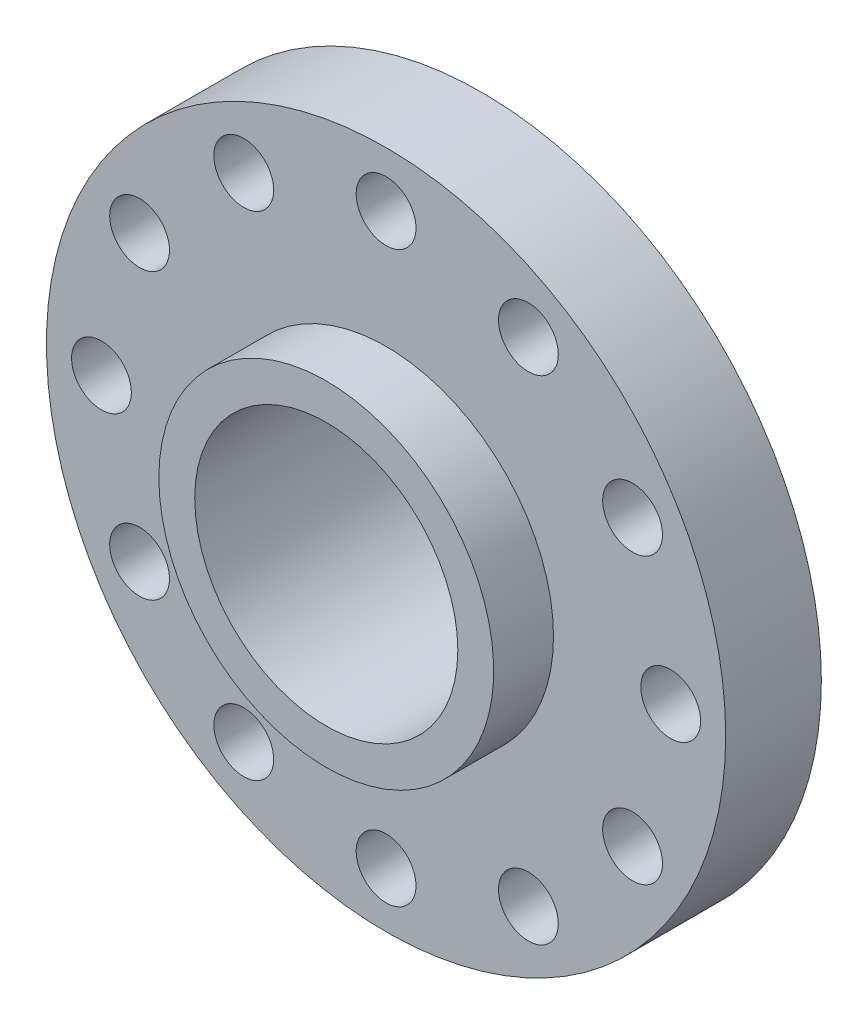
from build123d import *
from build123d.topology import SkipClean

# Parameters (mm, degrees)
SKETCH1_R           = 28.4
SKETCH1_R_2         = 11
BOSS_EXTRUDE1_DEPTH = 8
BOSS_EXTRUDE2_START = 5
SKETCH2_R           = 14
SKETCH2_R_2         = 11
BOSS_EXTRUDE2_DEPTH = 5
SKETCH3_R           = 2.5
CUT_EXTRUDE1_DEPTH  = 43.215163153
CIRPATTERN1_COUNT   = 12
SCALE1_SCALE        = 0.24


with BuildPart() as part:
    # Sketch1 → Boss-Extrude1 (new body)
    with BuildSketch(Plane.XY):
        Circle(SKETCH1_R)
        Circle(SKETCH1_R_2, mode=Mode.SUBTRACT)
    extrude(amount=BOSS_EXTRUDE1_DEPTH)

    # Sketch2 → Boss-Extrude2 (add)
    with SkipClean():  # the faces are left unmerged after this step: merging them gives an invalid solid
        with BuildSketch(Plane(origin=(0, 0, 0), x_dir=(-1, 0, 0), z_dir=(0, 0, -1)).offset(BOSS_EXTRUDE2_START)):
            with Locations(Location((0, 0, 0), (0, 0, 180))):
                Circle(SKETCH2_R)
            Circle(SKETCH2_R_2, mode=Mode.SUBTRACT)
        boss_extrude2 = extrude(amount=-BOSS_EXTRUDE2_DEPTH)

    # Mirror1: Boss-Extrude2 across plane
    add(boss_extrude2.mirror(Plane.XY.offset(4)))

    # Sketch3 → Cut-Extrude1 (cut, through all)
    with BuildSketch(Plane(origin=(0, 0, 0), x_dir=(-1, 0, 0), z_dir=(0, 0, -1))):
        with Locations((11.9, 20.61140461)):
            Circle(SKETCH3_R)
    cut_extrude1 = extrude(amount=-CUT_EXTRUDE1_DEPTH, mode=Mode.SUBTRACT)

    # CirPattern1: Cut-Extrude1 ×12 about axis
    cirpattern1_axis = Axis((0, 0, 0), (0, 0, 1))
    for i in range(1, CIRPATTERN1_COUNT):
        add(cut_extrude1.rotate(cirpattern1_axis, i * 360 / CIRPATTERN1_COUNT), mode=Mode.SUBTRACT)


with BuildPart() as part_1:
    # Scale1: scaled about (0, 0, 4)
    add(part.part.scale(SCALE1_SCALE).moved(Location((0, 0, 3.04))))


solid = part_1.part
